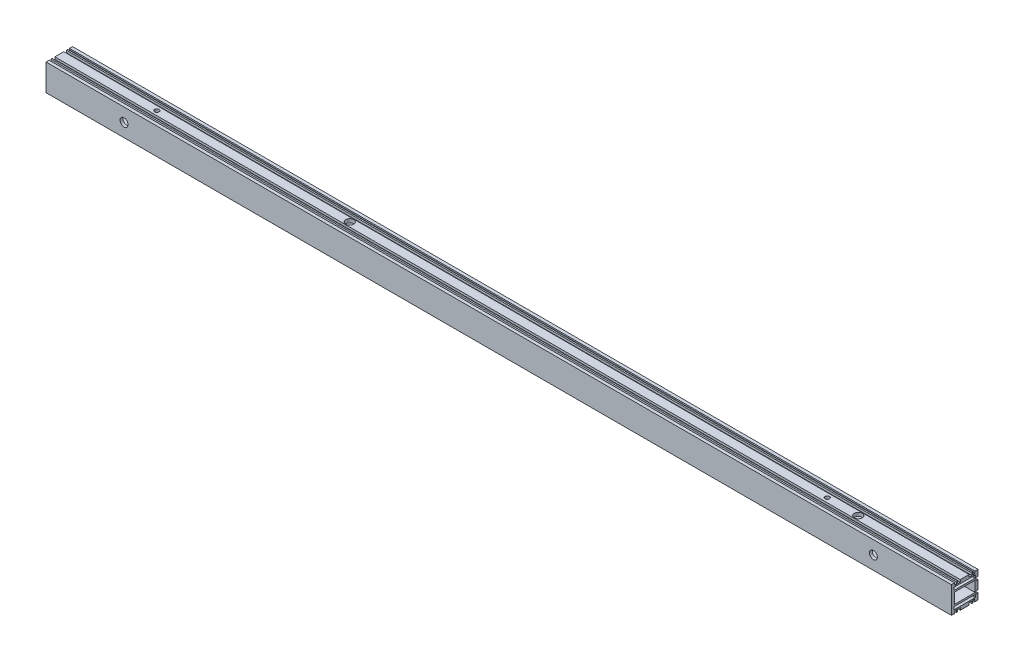
from build123d import *

# Parameters (mm, degrees)
SKETCH_1_W                = 23.5
SKETCH_1_H                = 12
EXTRUDE_1_DEPTH           = 510.5
HOLE_WIZARD_M6_1_D        = 5
HOLE_WIZARD_M6_1_DEPTH    = 15
HOLE_WIZARD_M6_1_TIP      = 1.502151548
HOLE_WIZARD_M6_2_D        = 5
HOLE_WIZARD_M6_2_DEPTH    = 15
HOLE_WIZARD_M6_2_TIP      = 1.502151548
HOLE_WIZARD_9_0_9_1_D     = 9
HOLE_WIZARD_M6_3_D        = 5
HOLE_WIZARD_M6_3_DEPTH    = 15
HOLE_WIZARD_M6_3_TIP      = 1.502151548
HOLE_WIZARD_M6_2_2_D      = 5
HOLE_WIZARD_M6_2_2_DEPTH  = 15
HOLE_WIZARD_M6_2_2_TIP    = 1.502151548
HOLE_WIZARD_7_0_7_1_D     = 7
HOLE_WIZARD_7_0_7_1_DEPTH = 15
HOLE_WIZARD_7_0_7_1_TIP   = 2.103012167
HOLE_WIZARD_9_0_9_2_D     = 9


with BuildPart() as part:
    # 草图1 → 凸台-拉伸1 (new, symmetric)
    with BuildSketch(Plane(origin=(0, 0, 0), x_dir=(0, 0, -1), z_dir=(1, 0, 0))):
        Polygon((-15, 15), (-11.5, 15), (-11.5, 13.5), (-11, 13.5), (-11, 12), (-9.5, 12), (-9.5, 15), (-8, 15), (-8, 12.5), (-5, 12.5), (-5, 15), (5, 15), (5, 12.5), (8, 12.5), (8, 15), (9.5, 15), (9.5, 12), (11, 12), (11, 13.5), (11.5, 13.5), (11.5, 15), (15, 15), (15, 8), (12.5, 8), (12.5, 5), (15, 5), (15, -5), (12.5, -5), (12.5, -8), (15, -8), (15, -15), (11.5, -15), (11.5, -13.5), (11, -13.5), (11, -12), (9.5, -12), (9.5, -15), (8, -15), (8, -12.5), (5, -12.5), (5, -15), (-5, -15), (-5, -12.5), (-8, -12.5), (-8, -15), (-9.5, -15), (-9.5, -12), (-11, -12), (-11, -13.5), (-11.5, -13.5), (-11.5, -15), (-15, -15), align=None)
        with BuildLine():
            Line((12, -10.5), (12, -8.5))
            ThreePointArc((12, -8.5), (11.853553391, -8.146446609), (11.5, -8))
            Line((11.5, -8), (-11.5, -8))
            ThreePointArc((-11.5, -8), (-11.853553391, -8.146446609), (-12, -8.5))
            Line((-12, -8.5), (-12, -10.5))
            ThreePointArc((-12, -10.5), (-11.853553391, -10.853553391), (-11.5, -11))
            Line((-11.5, -11), (11.5, -11))
            ThreePointArc((11.5, -11), (11.853553391, -10.853553391), (12, -10.5))
        make_face(mode=Mode.SUBTRACT)
        with BuildLine():
            Line((-11.5, 11), (11.5, 11))
            ThreePointArc((11.5, 11), (11.853553391, 10.853553391), (12, 10.5))
            Line((12, 10.5), (12, 8.5))
            ThreePointArc((12, 8.5), (11.853553391, 8.146446609), (11.5, 8))
            Line((11.5, 8), (-11.5, 8))
            ThreePointArc((-11.5, 8), (-11.853553391, 8.146446609), (-12, 8.5))
            Line((-12, 8.5), (-12, 10.5))
            ThreePointArc((-12, 10.5), (-11.853553391, 10.853553391), (-11.5, 11))
        make_face(mode=Mode.SUBTRACT)
        Rectangle(SKETCH_1_W, SKETCH_1_H, mode=Mode.SUBTRACT)
    extrude(amount=EXTRUDE_1_DEPTH, both=True)

    # M6 螺纹孔1
    with Locations(Plane(origin=(0, 0, -15), x_dir=(-1, 0, 0), z_dir=(0, 0, -1))):
        with Locations((460.5, 0), (-460.5, 0), (445.5, 0), (-445.5, 0), (368.5, 0), (317.5, 0)):
            Hole(HOLE_WIZARD_M6_1_D / 2, depth=HOLE_WIZARD_M6_1_DEPTH)
            with Locations((0, 0, -(HOLE_WIZARD_M6_1_DEPTH + HOLE_WIZARD_M6_1_TIP / 2))):  # 118° drill point
                Cone(0, HOLE_WIZARD_M6_1_D / 2, HOLE_WIZARD_M6_1_TIP, mode=Mode.SUBTRACT)

    # Hole Wizard M6 _2
    with Locations(Plane(origin=(0, -15, 0), x_dir=(-1, 0, 0), z_dir=(0, -1, 0))):
        with Locations((-460.5, 0), (-230.5, 0), (460.5, 0), (-445.5, 0), (-215.5, 0), (445.5, 0)):
            Hole(HOLE_WIZARD_M6_2_D / 2, depth=HOLE_WIZARD_M6_2_DEPTH)
            with Locations((0, 0, -(HOLE_WIZARD_M6_2_DEPTH + HOLE_WIZARD_M6_2_TIP / 2))):  # 118° drill point
                Cone(0, HOLE_WIZARD_M6_2_D / 2, HOLE_WIZARD_M6_2_TIP, mode=Mode.SUBTRACT)

    # Ø9.0 (9) 直径孔1 (through all)
    with Locations(Plane.XY.offset(15)):
        with Locations((-422.5, 0), (422.5, 0)):
            Hole(HOLE_WIZARD_9_0_9_1_D / 2)

    # M6 螺纹孔3
    with Locations(Plane(origin=(0, 15, 0), x_dir=(1, 0, 0), z_dir=(0, 1, 0))):
        with Locations((355.5, 0), (-400.5, 0)):
            Hole(HOLE_WIZARD_M6_3_D / 2, depth=HOLE_WIZARD_M6_3_DEPTH)
            with Locations((0, 0, -(HOLE_WIZARD_M6_3_DEPTH + HOLE_WIZARD_M6_3_TIP / 2))):  # 118° drill point
                Cone(0, HOLE_WIZARD_M6_3_D / 2, HOLE_WIZARD_M6_3_TIP, mode=Mode.SUBTRACT)

    # Hole Wizard M6 _2 2
    with Locations(Plane(origin=(0, -15, 0), x_dir=(-1, 0, 0), z_dir=(0, -1, 0))):
        with Locations((-215.5, 0), (-230.5, 0)):
            Hole(HOLE_WIZARD_M6_2_2_D / 2, depth=HOLE_WIZARD_M6_2_2_DEPTH)
            with Locations((0, 0, -(HOLE_WIZARD_M6_2_2_DEPTH + HOLE_WIZARD_M6_2_2_TIP / 2))):  # 118° drill point
                Cone(0, HOLE_WIZARD_M6_2_2_D / 2, HOLE_WIZARD_M6_2_2_TIP, mode=Mode.SUBTRACT)

    # Ø7.0 (7) 直径孔1
    with Locations(Plane(origin=(0, -15, 0), x_dir=(-1, 0, 0), z_dir=(0, -1, 0))):
        with Locations((-355.5, 0), (400.5, 0)):
            Hole(HOLE_WIZARD_7_0_7_1_D / 2, depth=HOLE_WIZARD_7_0_7_1_DEPTH)
            with Locations((0, 0, -(HOLE_WIZARD_7_0_7_1_DEPTH + HOLE_WIZARD_7_0_7_1_TIP / 2))):  # 118° drill point
                Cone(0, HOLE_WIZARD_7_0_7_1_D / 2, HOLE_WIZARD_7_0_7_1_TIP, mode=Mode.SUBTRACT)

    # Ø9.0 (9) 直径孔2 (through all)
    with Locations(Plane(origin=(0, -15, 0), x_dir=(-1, 0, 0), z_dir=(0, -1, 0))):
        with Locations((-390.5, 0), (183, 0)):
            Hole(HOLE_WIZARD_9_0_9_2_D / 2)


solid = part.part
